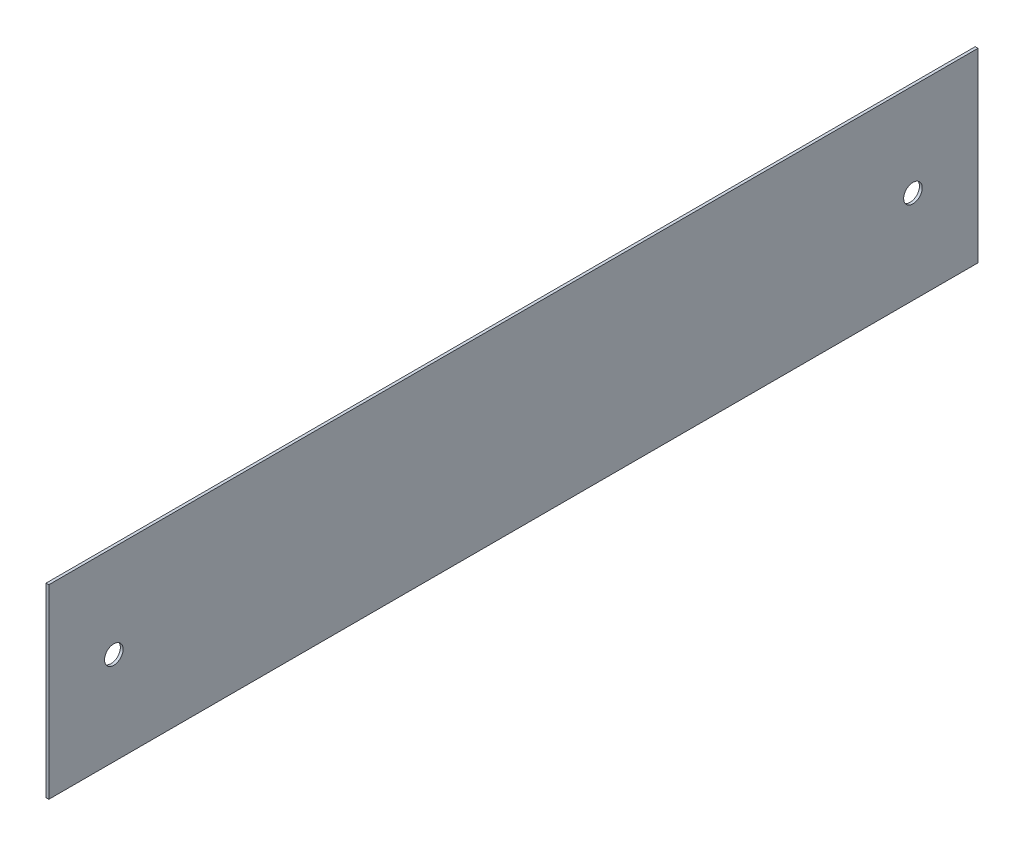
from build123d import *

# Parameters (mm, degrees)
SKETCH1_W           = 1000
SKETCH1_H           = 200
EXTRUDE_THIN1_DEPTH = 3
SKETCH3_R           = 10
CUT_EXTRUDE2_DEPTH  = 5


with BuildPart() as part:
    # Sketch1 → Extrude-Thin1 (new body)
    with BuildSketch(Plane(origin=(0, 0, 0), x_dir=(0, 0, -1), z_dir=(1, 0, 0))):
        with Locations((0, -100)):
            Rectangle(SKETCH1_W, SKETCH1_H)
    extrude(amount=EXTRUDE_THIN1_DEPTH)

    # Sketch3 → Cut-Extrude2 (cut)
    with BuildSketch(Plane(origin=(3, 0, 0), x_dir=(0, 0, -1), z_dir=(1, 0, 0))):
        with Locations((-430, -100)):
            Circle(SKETCH3_R)
        with Locations((430, -100)):
            Circle(SKETCH3_R)
    extrude(amount=-CUT_EXTRUDE2_DEPTH, mode=Mode.SUBTRACT)


solid = part.part
